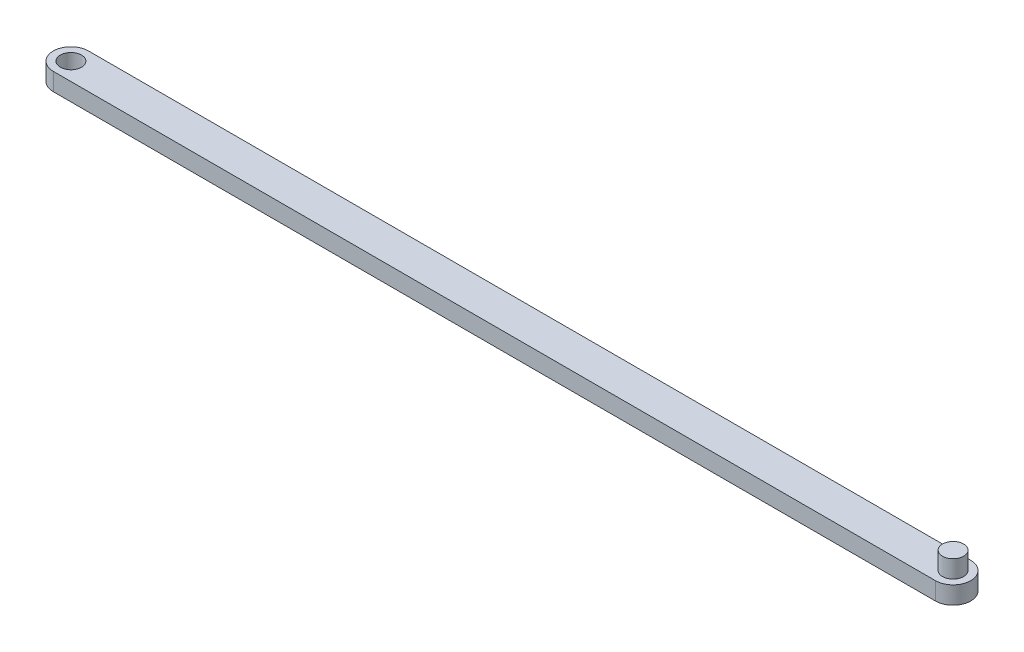
from build123d import *

# Parameters (mm, degrees)
SKETCH_1_R      = 3
EXTRUDE_1_DEPTH = 5
SKETCH_2_R      = 3
EXTRUDE_2_DEPTH = 5


with BuildPart() as part:
    # 草图1 → 凸台-拉伸1 (new body)
    with BuildSketch(Plane(origin=(0, 0, 0), x_dir=(1, 0, 0), z_dir=(0, 1, 0))):
        with BuildLine():
            Line((-92.110125605, 6.217636835), (157.889874395, 6.217636835))
            ThreePointArc((157.889874395, 6.217636835), (162.889874395, 1.217636835), (157.889874395, -3.782363165))
            Line((157.889874395, -3.782363165), (-92.110125605, -3.782363165))
            ThreePointArc((-92.110125605, -3.782363165), (-97.110125605, 1.217636835), (-92.110125605, 6.217636835))
        make_face()
        with Locations(Location((-92.110125605, 1.217636835, 0), (0, 0, 270))):
            Circle(SKETCH_1_R, mode=Mode.SUBTRACT)
    extrude(amount=EXTRUDE_1_DEPTH)

    # 草图2 → 凸台-拉伸2 (add)
    with BuildSketch(Plane(origin=(0, 5, 0), x_dir=(1, 0, 0), z_dir=(0, 1, 0))):
        with Locations(Location((157.889874395, 1.217636835, 0), (0, 0, 270))):
            Circle(SKETCH_2_R)
    extrude(amount=EXTRUDE_2_DEPTH)


solid = part.part
